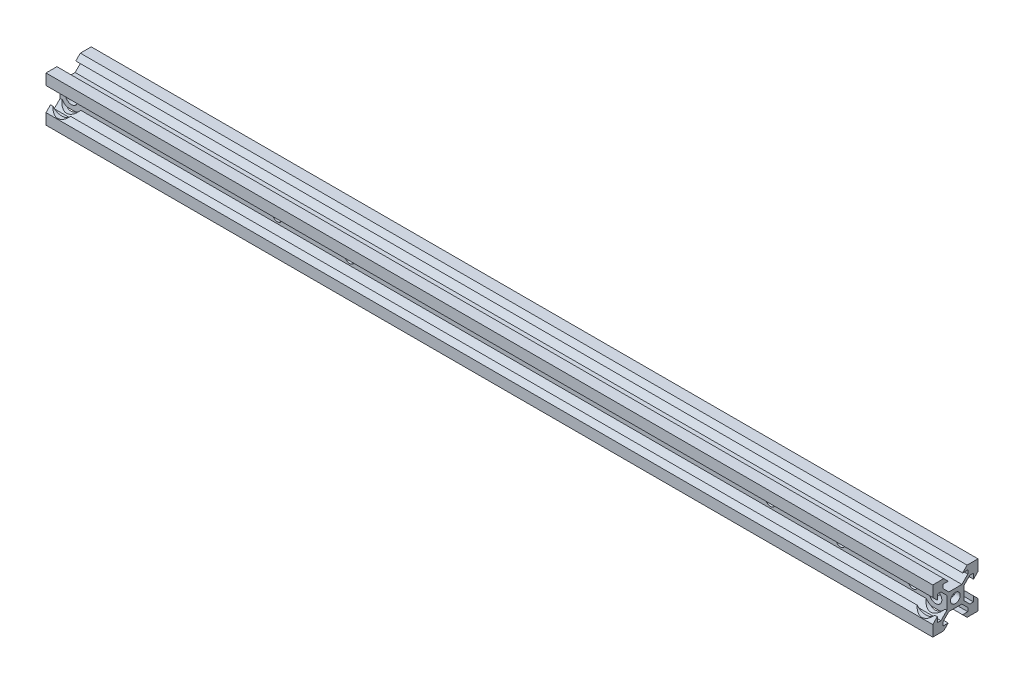
from build123d import *

# Parameters (mm, degrees)
SKETCH11_R                             = 2.15
F_20X20_ENDER_CONFIGURED_20X20_1_DEPTH = 392
M5X0_8_TAPPED_HOLE1_D                  = 4.2
CBORE_FOR_M5_SHCS1_D                   = 5.5
CBORE_FOR_M5_SHCS1_CBORE_D             = 10
CBORE_FOR_M5_SHCS1_CBORE_DEPTH         = 6.25
M5X0_8_TAPPED_HOLE2_D                  = 4.2


with BuildPart() as part:
    # Sketch11 → 20x20-ender - configured 20X20(1) (new body)
    with BuildSketch(Plane.YZ.offset(-196)):
        Polygon((-10, 10), (-5.175, 10), (-3.175, 8), (-5.5, 8), (-5.5, 6.383883477), (-2.866116524, 3.75), (2.866116524, 3.75), (5.5, 6.383883476), (5.5, 8), (3.175, 8), (5.175, 10), (10, 10), (10, 5.175), (8, 3.175), (8, 5.5), (6.383883476, 5.5), (3.75, 2.866116524), (3.75, -2.866116524), (6.383883476, -5.5), (8, -5.5), (8, -3.175), (10, -5.175), (10, -10), (5.175, -10), (3.175, -8), (5.5, -8), (5.5, -6.383883476), (2.866116524, -3.75), (-2.866116524, -3.75), (-5.5, -6.383883476), (-5.5, -8), (-3.175, -8), (-5.175, -10), (-10, -10), (-10, -5.175), (-8, -3.175), (-8, -5.5), (-6.383883476, -5.5), (-3.75, -2.866116524), (-3.75, 2.866116524), (-6.383883476, 5.5), (-8, 5.5), (-8, 3.175), (-10, 5.175), align=None)
        Circle(SKETCH11_R, mode=Mode.SUBTRACT)
    extrude(amount=F_20X20_ENDER_CONFIGURED_20X20_1_DEPTH)

    # M5x0.8 Tapped Hole1 (through all)
    with Locations(Plane.XY.offset(3.75)):
        with Locations((181, 0), (149, 0), (-100, 0), (-68, 0)):
            Hole(M5X0_8_TAPPED_HOLE1_D / 2)

    # CBORE for M5 SHCS1 (through all)
    with Locations(Plane.XY.offset(10)):
        with Locations((-191, 0), (191, 0)):
            CounterBoreHole(CBORE_FOR_M5_SHCS1_D / 2, CBORE_FOR_M5_SHCS1_CBORE_D / 2, CBORE_FOR_M5_SHCS1_CBORE_DEPTH)

    # M5x0.8 Tapped Hole2 (through all)
    with Locations(Plane.XY.offset(3.75)):
        with Locations((118, 0)):
            Hole(M5X0_8_TAPPED_HOLE2_D / 2)


solid = part.part
